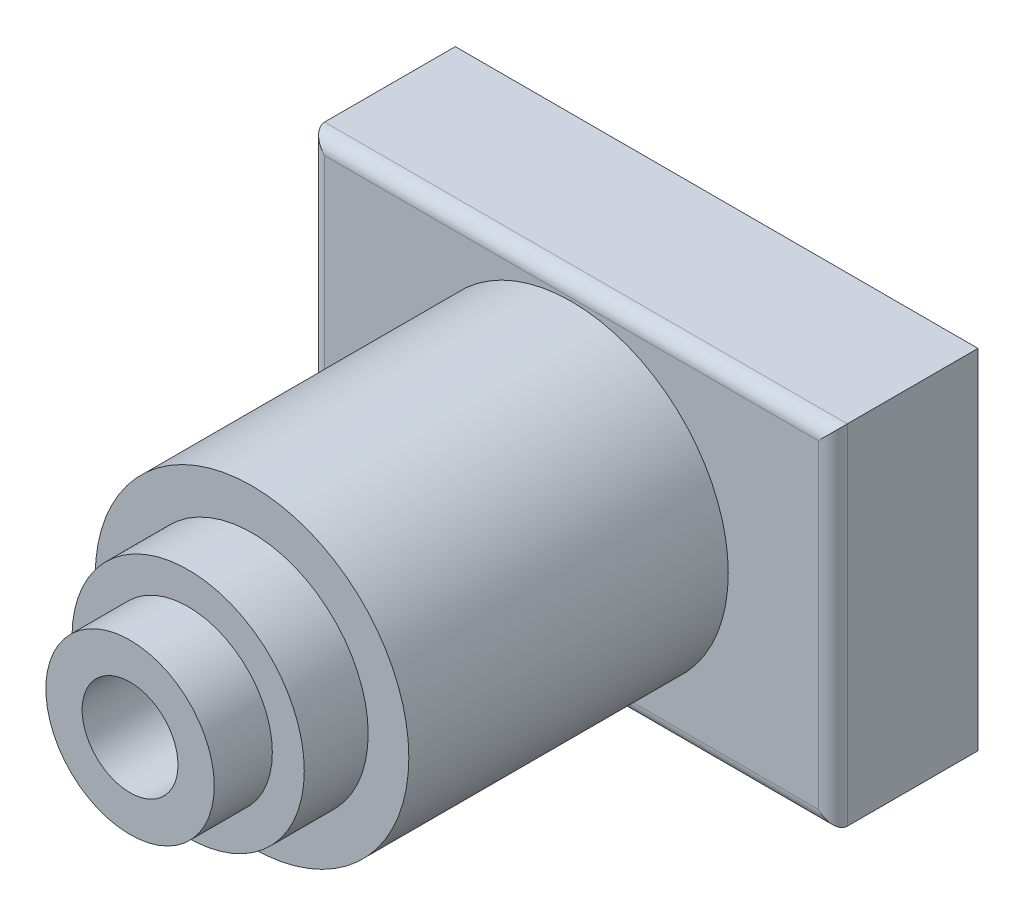
from build123d import *

# Parameters (mm, degrees)
SKETCH_1_W          = 18
SKETCH_1_H          = 12
EXTRUDE_1_DEPTH     = 5
SKETCH_2_R          = 5.4
EXTRUDE_2_DEPTH     = 11
SKETCH_3_R          = 4
EXTRUDE_3_DEPTH     = 2.2
SKETCH_4_R          = 2.9
EXTRUDE_4_DEPTH     = 2
SKETCH_5_R          = 1.65
CUT_EXTRUDE_1_DEPTH = 25
SKETCH_6_R          = 4.5
CUT_EXTRUDE_2_DEPTH = 2
FILLET_1_R          = 0.5


with BuildPart() as part:
    # 草图1 → 凸台-拉伸1 (new body)
    with BuildSketch(Plane.XY):
        Rectangle(SKETCH_1_W, SKETCH_1_H)
    extrude(amount=EXTRUDE_1_DEPTH)

    # 草图2 → 凸台-拉伸2 (add)
    with BuildSketch(Plane.XY.offset(5)):
        Circle(SKETCH_2_R)
    extrude(amount=EXTRUDE_2_DEPTH)

    # 草图3 → 凸台-拉伸3 (add)
    with BuildSketch(Plane.XY.offset(16)):
        Circle(SKETCH_3_R)
    extrude(amount=EXTRUDE_3_DEPTH)

    # 草图4 → 凸台-拉伸4 (add)
    with BuildSketch(Plane.XY.offset(18.2)):
        Circle(SKETCH_4_R)
    extrude(amount=EXTRUDE_4_DEPTH)

    # 草图5 → 切除-拉伸1 (cut)
    with BuildSketch(Plane.XY.offset(20.2)):
        Circle(SKETCH_5_R)
    extrude(amount=-CUT_EXTRUDE_1_DEPTH, mode=Mode.SUBTRACT)

    # 草图6 → 切除-拉伸2 (cut)
    with BuildSketch(Plane(origin=(0, 0, 0), x_dir=(-1, 0, 0), z_dir=(0, 0, -1))):
        Circle(SKETCH_6_R)
    extrude(amount=-CUT_EXTRUDE_2_DEPTH, mode=Mode.SUBTRACT)

    # 圆角1
    fillet_1_edges = [part.edges().sort_by_distance(p)[0] for p in [
        (-9, 0, 5),
        (0, -6, 5),
        (9, 0, 5),
        (0, 6, 5),
    ]]
    fillet(fillet_1_edges, radius=FILLET_1_R)


solid = part.part
